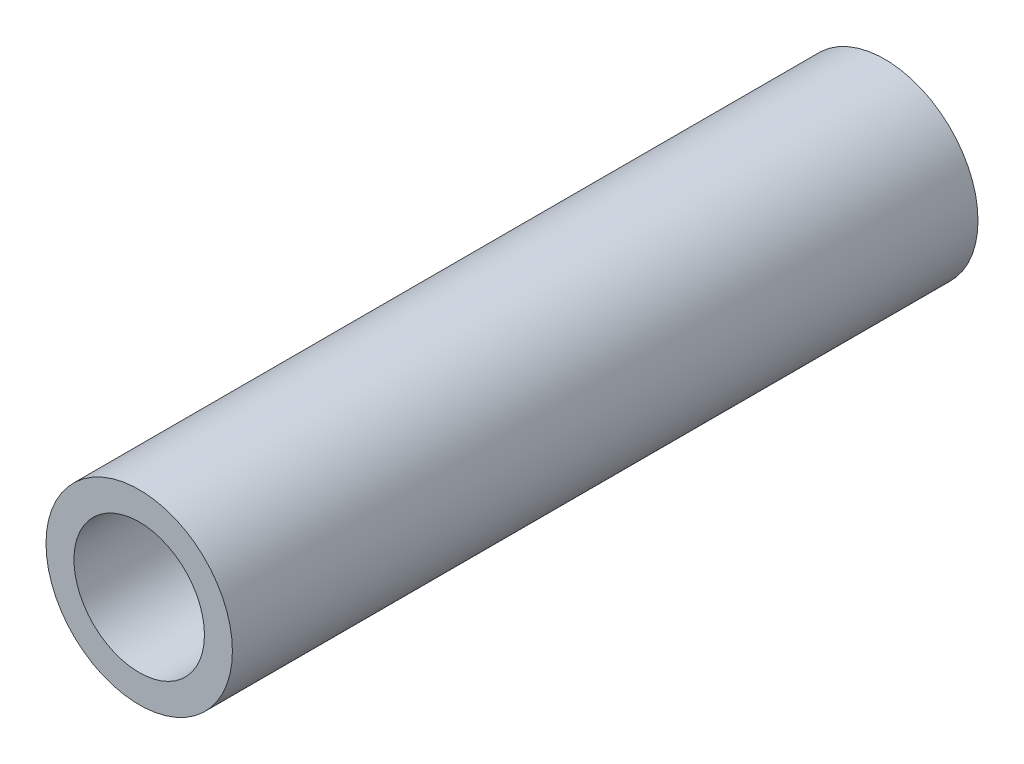
from build123d import *

# Parameters (mm, degrees)
SKETCH_1_R      = 2
SKETCH_1_R_2    = 1.4
EXTRUDE_1_DEPTH = 16


with BuildPart() as part:
    # 草图1 → 凸台-拉伸1 (new body)
    with BuildSketch(Plane.XY):
        Circle(SKETCH_1_R)
        Circle(SKETCH_1_R_2, mode=Mode.SUBTRACT)
    extrude(amount=EXTRUDE_1_DEPTH)


solid = part.part
